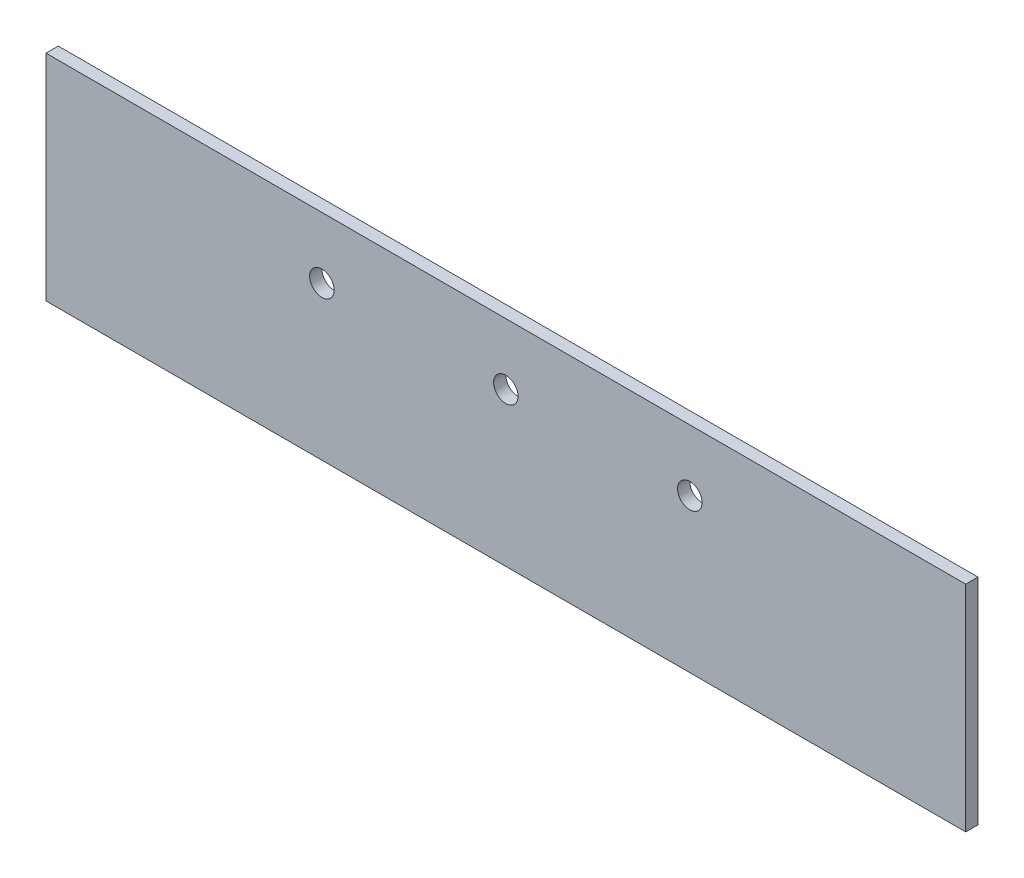
from build123d import *

# Parameters (mm, degrees)
SKETCH1_W           = 150
SKETCH1_H           = 35
BOSS_EXTRUDE1_DEPTH = 2
SKETCH2_R           = 2
FIX_HOLE_DEPTH      = 78.040573726


with BuildPart() as part:
    # Sketch1 → Boss-Extrude1 (new body)
    with BuildSketch(Plane.XY):
        Rectangle(SKETCH1_W, SKETCH1_H)
    extrude(amount=BOSS_EXTRUDE1_DEPTH)

    # Sketch2 → fix hole (cut, through all)
    with BuildSketch(Plane(origin=(0, 0, 0), x_dir=(-1, 0, 0), z_dir=(0, 0, -1))):
        with Locations(Location((30, 7.5, 0), (0, 0, 180))):
            Circle(SKETCH2_R)
        with Locations((0, 7.5)):
            Circle(SKETCH2_R)
        with Locations((-30, 7.5)):
            Circle(SKETCH2_R)
    extrude(amount=-FIX_HOLE_DEPTH, mode=Mode.SUBTRACT)


solid = part.part
